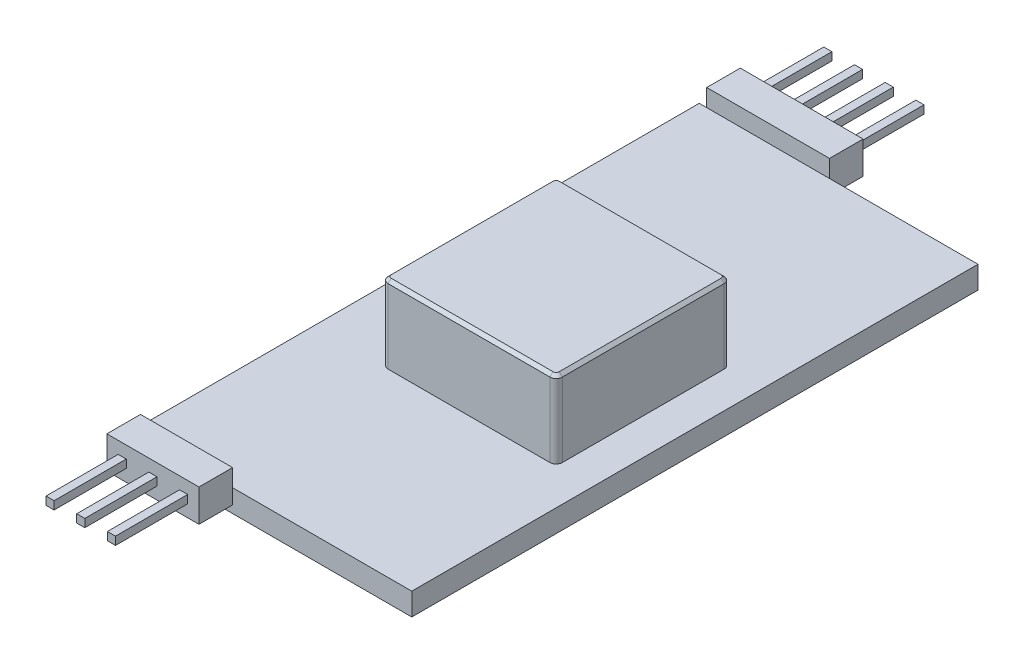
from build123d import *

# Parameters (mm, degrees)
SKETCH1_W           = 22.4
SKETCH1_H           = 45.5
BOSS_EXTRUDE1_DEPTH = 1.8
BOSS_EXTRUDE2_START = -1.8
SKETCH2_W           = 14
SKETCH2_H           = 14
BOSS_EXTRUDE2_DEPTH = 8
SKETCH3_W           = 7.4
SKETCH3_H           = 2.6
BOSS_EXTRUDE3_DEPTH = 2.7
SKETCH4_W           = 0.65
SKETCH4_H           = 0.65
BOSS_EXTRUDE4_DEPTH = 5.8
SKETCH6_W           = 9.867
SKETCH6_H           = 2.6
BOSS_EXTRUDE5_DEPTH = 2.7
SKETCH7_W           = 0.65
SKETCH7_H           = 0.65
BOSS_EXTRUDE6_DEPTH = 5.8
FILLET1_R           = 0.5
CHAMFER1_SIZE       = 0.25


with BuildPart() as part:
    # Sketch1 → Boss-Extrude1 (new body)
    with BuildSketch(Plane(origin=(0, 0, 0), x_dir=(1, 0, 0), z_dir=(0, 1, 0))):
        Rectangle(SKETCH1_W, SKETCH1_H)
    extrude(amount=BOSS_EXTRUDE1_DEPTH)

    # Sketch2 → Boss-Extrude2 (add)
    with BuildSketch(Plane(origin=(0, 1.8, 0), x_dir=(1, 0, 0), z_dir=(0, 1, 0)).offset(BOSS_EXTRUDE2_START)):
        with Locations((1.3, -1.25)):
            Rectangle(SKETCH2_W, SKETCH2_H)
    extrude(amount=BOSS_EXTRUDE2_DEPTH)

    # Sketch3 → Boss-Extrude3 (add)
    with BuildSketch(Plane.XY.offset(22.75)):
        with Locations((-6.9, 1.9)):
            Rectangle(SKETCH3_W, SKETCH3_H)
    extrude(amount=BOSS_EXTRUDE3_DEPTH)

    # Sketch4 → Boss-Extrude4 (add)
    with BuildSketch(Plane.XY.offset(25.45)):
        with Locations((-9.366666667, 1.9)):
            Rectangle(SKETCH4_W, SKETCH4_H)
        with Locations((-6.9, 1.9)):
            Rectangle(SKETCH4_W, SKETCH4_H)
        with Locations((-4.433333333, 1.9)):
            Rectangle(SKETCH4_W, SKETCH4_H)
    extrude(amount=BOSS_EXTRUDE4_DEPTH)

    # Sketch6 → Boss-Extrude5 (add)
    with BuildSketch(Plane(origin=(0, 0, -22.75), x_dir=(-1, 0, 0), z_dir=(0, 0, -1))):
        with Locations((5.6665, 1.9)):
            Rectangle(SKETCH6_W, SKETCH6_H)
    extrude(amount=BOSS_EXTRUDE5_DEPTH)

    # Sketch7 → Boss-Extrude6 (add)
    with BuildSketch(Plane(origin=(0, 0, -25.45), x_dir=(-1, 0, 0), z_dir=(0, 0, -1))):
        with Locations((1.966375, 1.9)):
            Rectangle(SKETCH7_W, SKETCH7_H)
        with Locations((4.433125, 1.9)):
            Rectangle(SKETCH7_W, SKETCH7_H)
        with Locations((6.899875, 1.9)):
            Rectangle(SKETCH7_W, SKETCH7_H)
        with Locations((9.366625, 1.9)):
            Rectangle(SKETCH7_W, SKETCH7_H)
    extrude(amount=BOSS_EXTRUDE6_DEPTH)

    # Fillet1
    fillet1_edges = [part.edges().sort_by_distance(p)[0] for p in [
        (8.3, 4.9, 8.25),
        (8.3, 4.9, -5.75),
        (-5.7, 4.9, -5.75),
        (-5.7, 4.9, 8.25),
    ]]
    fillet(fillet1_edges, radius=FILLET1_R)

    # Chamfer1
    chamfer1_edges = [part.edges().sort_by_distance(p)[0] for p in [
        (-5.7, 8, 1.25),
        (1.3, 8, -5.75),
        (8.3, 8, 1.25),
        (1.3, 8, 8.25),
        (-5.553553391, 8, 8.103553391),
        (8.153553391, 8, 8.103553391),
        (8.153553391, 8, -5.603553391),
        (-5.553553391, 8, -5.603553391),
    ]]
    chamfer(chamfer1_edges, length=CHAMFER1_SIZE)


solid = part.part
